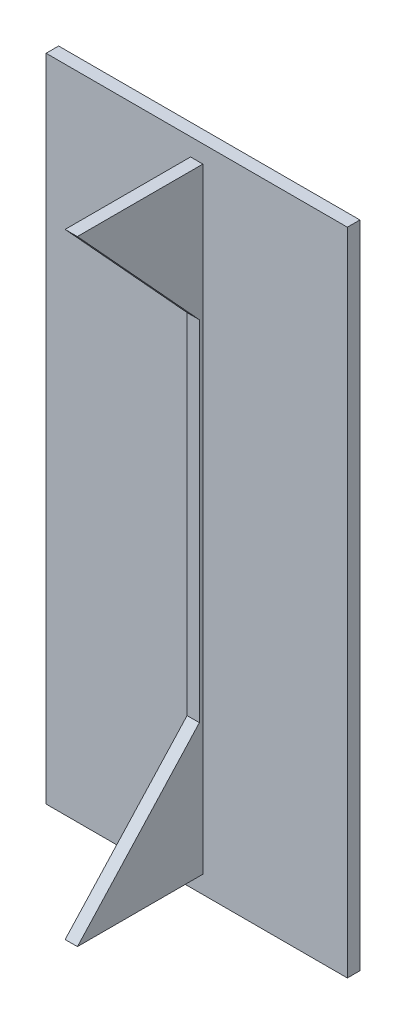
from build123d import *

# Parameters (mm, degrees)
SKICA1_W                 = 24
SKICA1_H                 = 51.8
P_IDAT_VYSUNUT_M2_DEPTH  = 1
SKICA2_W                 = 0.980102229
SKICA2_H                 = 51.8
P_IDAT_VYSUNUT_M3_DEPTH  = 0.28
SKICA3_W                 = 0.980102229
SKICA3_H                 = 12
P_IDAT_VYSUNUT_M5_DEPTH  = 11
ODEBRAT_VYSUNUT_M2_DEPTH = 11
ODEBRAT_VYSUNUT_M3_DEPTH = 11
SKICA9_W                 = 12.041997339
SKICA9_H                 = 1.4
ODEBRAT_VYSUNUT_M4_DEPTH = 11
SKICA10_W                = 11.638115032
SKICA10_H                = 1.404604082
ODEBRAT_VYSUNUT_M5_DEPTH = 11


with BuildPart() as part:
    # Skica1 → Přidat vysunutím2 (new body)
    with BuildSketch(Plane.XY):
        Rectangle(SKICA1_W, SKICA1_H)
    extrude(amount=P_IDAT_VYSUNUT_M2_DEPTH)

    # Skica2 → Přidat vysunutím3 (add)
    with BuildSketch(Plane.XY.offset(1)):
        with Locations((5.1115e-05, 0)):
            Rectangle(SKICA2_W, SKICA2_H)
    extrude(amount=P_IDAT_VYSUNUT_M3_DEPTH)

    # Skica3 → Přidat vysunutím5 (add)
    with BuildSketch(Plane.XY.offset(1.28)):
        with Locations((5.1115e-05, 19.9)):
            Rectangle(SKICA3_W, SKICA3_H)
        with Locations((5.1115e-05, -19.9)):
            Rectangle(SKICA3_W, SKICA3_H)
    extrude(amount=P_IDAT_VYSUNUT_M5_DEPTH)

    # Skica6 → Odebrat vysunutím2 (cut)
    with BuildSketch(Plane(origin=(0.490102229, 0, 0), x_dir=(0, 0, -1), z_dir=(1, 0, 0))):
        Polygon((-12.28, 25.9), (-12.28, 13.9), (-1.28, 13.9), align=None)
    extrude(amount=-ODEBRAT_VYSUNUT_M2_DEPTH, mode=Mode.SUBTRACT)

    # Skica7 → Odebrat vysunutím3 (cut)
    with BuildSketch(Plane.ZY.offset(0.49)):
        Polygon((12.28, -13.9), (12.28, -25.9), (1.28, -13.9), align=None)
    extrude(amount=-ODEBRAT_VYSUNUT_M3_DEPTH, mode=Mode.SUBTRACT)

    # Skica9 → Odebrat vysunutím4 (cut)
    with BuildSketch(Plane.ZY.offset(0.49)):
        with Locations((7.02099867, 25.2)):
            Rectangle(SKICA9_W, SKICA9_H)
    extrude(amount=-ODEBRAT_VYSUNUT_M4_DEPTH, mode=Mode.SUBTRACT)

    # Skica10 → Odebrat vysunutím5 (cut)
    with BuildSketch(Plane.ZY.offset(0.49)):
        with Locations((6.819057516, -25.197697959)):
            Rectangle(SKICA10_W, SKICA10_H)
    extrude(amount=-ODEBRAT_VYSUNUT_M5_DEPTH, mode=Mode.SUBTRACT)


solid = part.part
